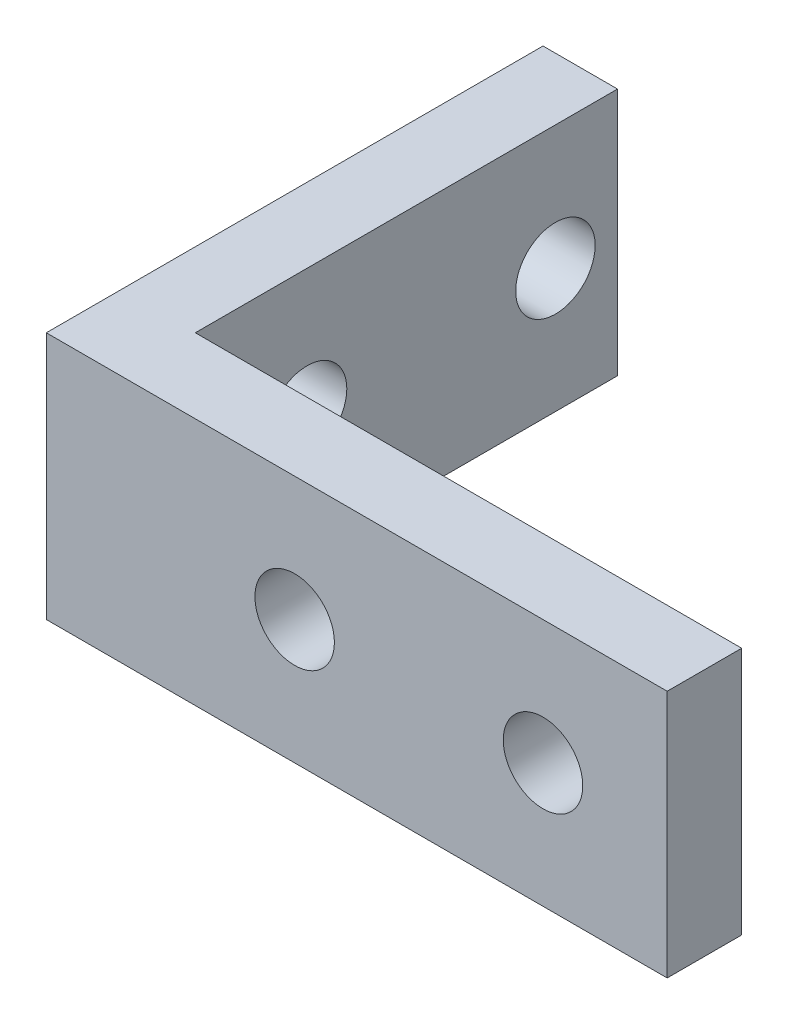
from build123d import *

# Parameters (mm, degrees)
BOSS_EXTRUDE2_DEPTH = 10
SKETCH2_R           = 1.6
CUT_EXTRUDE1_DEPTH  = 10
SKETCH3_R           = 1.6
CUT_EXTRUDE2_DEPTH  = 10


with BuildPart() as part:
    # Sketch1 → Boss-Extrude2 (new body)
    with BuildSketch(Plane(origin=(0, 0, 0), x_dir=(1, 0, 0), z_dir=(0, 1, 0))):
        Polygon((0, 0), (0, 20), (3, 20), (3, 3), (25, 3), (25, 0), align=None)
    extrude(amount=BOSS_EXTRUDE2_DEPTH)

    # Sketch2 → Cut-Extrude1 (cut)
    with BuildSketch(Plane.XY):
        with Locations((20, 5)):
            Circle(SKETCH2_R)
        with Locations((10, 5)):
            Circle(SKETCH2_R)
    extrude(amount=-CUT_EXTRUDE1_DEPTH, mode=Mode.SUBTRACT)

    # Sketch3 → Cut-Extrude2 (cut)
    with BuildSketch(Plane(origin=(3, 0, 0), x_dir=(0, 0, -1), z_dir=(1, 0, 0))):
        with Locations((7.5, 5)):
            Circle(SKETCH3_R)
        with Locations((17.5, 5)):
            Circle(SKETCH3_R)
    extrude(amount=-CUT_EXTRUDE2_DEPTH, mode=Mode.SUBTRACT)


solid = part.part
